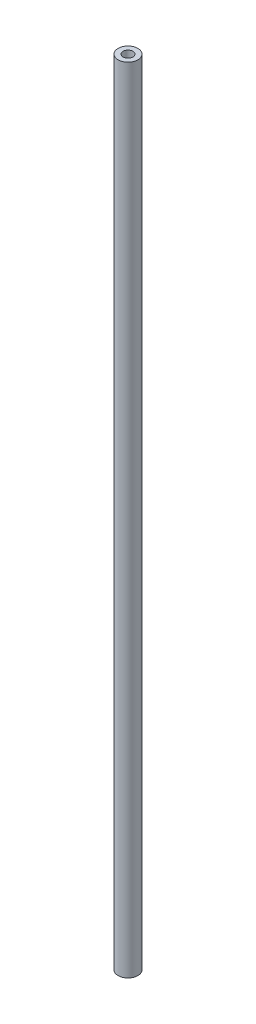
from build123d import *

# Parameters (mm, degrees)
SKETCH1_R           = 25
SKETCH1_R_2         = 12.5
BOSS_EXTRUDE1_DEPTH = 2000


with BuildPart() as part:
    # Sketch1 → Boss-Extrude1 (new body)
    with BuildSketch(Plane(origin=(0, 0, 0), x_dir=(1, 0, 0), z_dir=(0, 1, 0))):
        with Locations(Location((0, 0, 0), (0, 0, 270))):
            Circle(SKETCH1_R)
        with Locations(Location((0, 0, 0), (0, 0, 270))):
            Circle(SKETCH1_R_2, mode=Mode.SUBTRACT)
    extrude(amount=BOSS_EXTRUDE1_DEPTH)


solid = part.part
